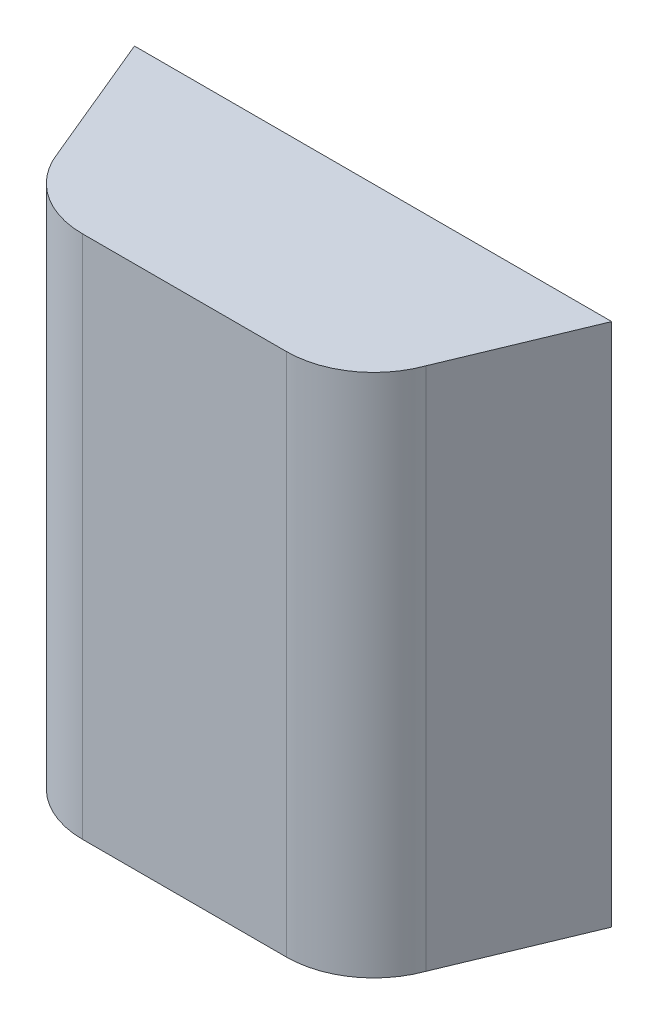
from build123d import *

# Parameters (mm, degrees)
BOSS_EXTRUDE1_DEPTH = 180
CUT_EXTRUDE1_DEPTH  = 176


with BuildPart() as part:
    # Sketch1 → Boss-Extrude1 (new body)
    with BuildSketch(Plane(origin=(0, 0, 0), x_dir=(1, 0, 0), z_dir=(0, 1, 0))):
        with BuildLine():
            Line((35, 0), (-35, 0))
            ThreePointArc((-35, 0), (-52.207293091, 5.425438671), (-63.190778624, 19.7393957))
            Line((-63.190778624, 19.7393957), (-81.908713693, 64.7393957))
            Line((-81.908713693, 64.7393957), (81.908713693, 64.7393957))
            Line((81.908713693, 64.7393957), (63.190778624, 19.7393957))
            ThreePointArc((63.190778624, 19.7393957), (52.207293091, 5.425438671), (35, 0))
        make_face()
    extrude(amount=BOSS_EXTRUDE1_DEPTH)

    # Sketch4 → Cut-Extrude1 (cut)
    with BuildSketch(Plane.XZ):
        with BuildLine():
            Line((-78.908713693, -64.7393957), (78.908713693, -64.7393957))
            Line((78.908713693, -64.7393957), (60.788869437, -21.764400459))
            add(Edge.make_bspline(
                [(35, -3), (54.769523096, -6.842262635), (60.788869437, -21.764400459)],
                knots=[0, 0, 0, 1, 1, 1], degree=2))
            Line((35, -3), (-35, -3))
            add(Edge.make_bspline(
                [(-35, -3), (-54.769523096, -6.842262635), (-60.788869437, -21.764400459)],
                knots=[0, 0, 0, 1, 1, 1], degree=2))
            Line((-60.788869437, -21.764400459), (-78.908713693, -64.7393957))
        make_face()
    extrude(amount=-CUT_EXTRUDE1_DEPTH, mode=Mode.SUBTRACT)


solid = part.part
